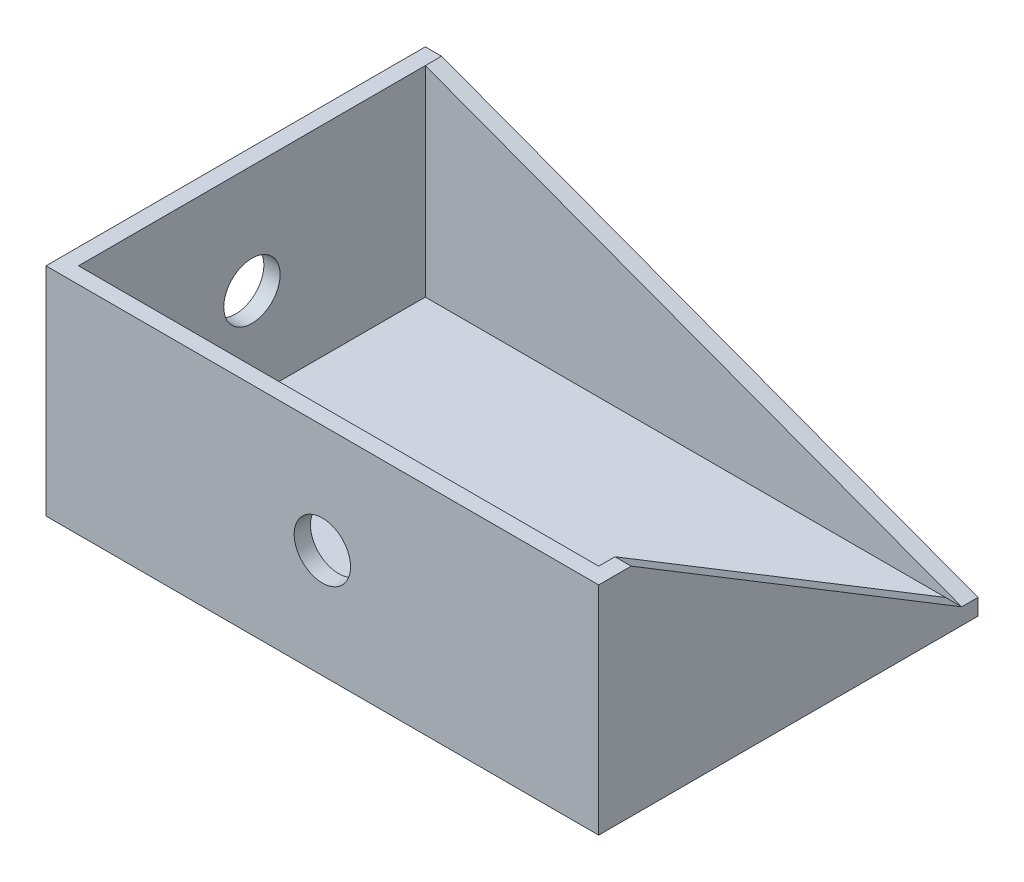
from build123d import *

# Parameters (mm, degrees)
SKETCH_1_W          = 51
SKETCH_1_H          = 35
EXTRUDE_1_DEPTH     = 20
SKETCH_2_W          = 48
SKETCH_2_H          = 32
CUT_EXTRUDE_1_DEPTH = 18.5
SKETCH_3_R          = 2.6
CUT_EXTRUDE_2_DEPTH = 3
SKETCH_4_R          = 2.6
CUT_EXTRUDE_3_DEPTH = 3
CUT_EXTRUDE_4_DEPTH = 1.5
CUT_EXTRUDE_5_DEPTH = 3


with BuildPart() as part:
    # 草图1 → 凸台-拉伸1 (new body)
    with BuildSketch(Plane(origin=(0, 0, 0), x_dir=(1, 0, 0), z_dir=(0, 1, 0))):
        with Locations((25.5, 17.5)):
            Rectangle(SKETCH_1_W, SKETCH_1_H)
    extrude(amount=EXTRUDE_1_DEPTH)

    # 草图2 → 切除-拉伸1 (cut)
    with BuildSketch(Plane(origin=(0, 20, 0), x_dir=(1, 0, 0), z_dir=(0, 1, 0))):
        with Locations((25.5, 17.5)):
            Rectangle(SKETCH_2_W, SKETCH_2_H)
    extrude(amount=-CUT_EXTRUDE_1_DEPTH, mode=Mode.SUBTRACT)

    # 草图3 → 切除-拉伸2 (cut)
    with BuildSketch(Plane.XY):
        with Locations((25.5, 10)):
            Circle(SKETCH_3_R)
    extrude(amount=-CUT_EXTRUDE_2_DEPTH, mode=Mode.SUBTRACT)

    # 草图4 → 切除-拉伸3 (cut)
    with BuildSketch(Plane.ZY):
        with Locations((-17.5, 10)):
            Circle(SKETCH_4_R)
    extrude(amount=-CUT_EXTRUDE_3_DEPTH, mode=Mode.SUBTRACT)

    # 草图5 → 切除-拉伸4 (cut)
    with BuildSketch(Plane(origin=(0, 0, -35), x_dir=(-1, 0, 0), z_dir=(0, 0, -1))):
        Polygon((-51, 20), (-1.5, 20), (-51, 1.5), align=None)
    extrude(amount=-CUT_EXTRUDE_4_DEPTH, mode=Mode.SUBTRACT)

    # 草图6 → 切除-拉伸5 (cut)
    with BuildSketch(Plane(origin=(51, 0, 0), x_dir=(0, 0, -1), z_dir=(1, 0, 0))):
        Polygon((33.5, 20), (33.5, 1.5), (3, 20), align=None)
    extrude(amount=-CUT_EXTRUDE_5_DEPTH, mode=Mode.SUBTRACT)


solid = part.part
